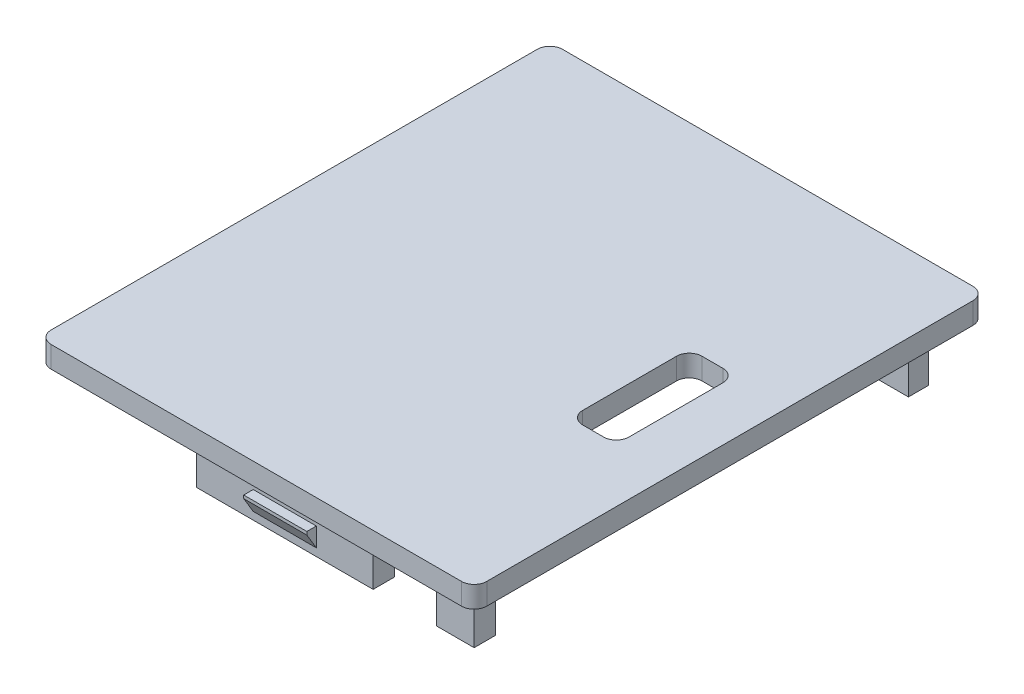
from build123d import *

# Parameters (mm, degrees)
SKETCH1_W           = 34.5
SKETCH1_H           = 40.5
BOSS_EXTRUDE1_DEPTH = 1.7
SKETCH2_W           = 3.66
SKETCH2_H           = 9.44
CUT_EXTRUDE1_DEPTH  = 1.7
FILLET1_R           = 1
FILLET2_R           = 1
FILLET3_R           = 1
FILLET4_R           = 1
FILLET5_R           = 1
FILLET6_R           = 1
FILLET7_R           = 1
FILLET8_R           = 1
SKETCH3_W           = 30
SKETCH3_H           = 1.6
BOSS_EXTRUDE2_DEPTH = 4.6
SKETCH4_W           = 3
SKETCH4_H           = 1.7
SKETCH4_W_2         = 14
BOSS_EXTRUDE3_DEPTH = 4.6
BOSS_EXTRUDE4_START = -14.75
BOSS_EXTRUDE4_DEPTH = 5
FILLET9_R           = 1
FILLET10_R          = 1
FILLET11_R          = 1


with BuildPart() as part:
    # Sketch1 → Boss-Extrude1 (new body)
    with BuildSketch(Plane(origin=(0, 0, 0), x_dir=(1, 0, 0), z_dir=(0, 1, 0))):
        with Locations((-2.298701299, -3.199675325)):
            Rectangle(SKETCH1_W, SKETCH1_H)
    extrude(amount=BOSS_EXTRUDE1_DEPTH)

    # Sketch2 → Cut-Extrude1 (cut)
    with BuildSketch(Plane(origin=(0, 1.7, 0), x_dir=(1, 0, 0), z_dir=(0, 1, 0))):
        with Locations((8.851298701, -3.199675325)):
            Rectangle(SKETCH2_W, SKETCH2_H)
    extrude(amount=-CUT_EXTRUDE1_DEPTH, mode=Mode.SUBTRACT)

    # Fillet1
    fillet1_edges = [part.edges().sort_by_distance(p)[0] for p in [
        (14.951298701, 0.85, 23.449675325),
    ]]
    fillet(fillet1_edges, radius=FILLET1_R)

    # Fillet2
    fillet2_edges = [part.edges().sort_by_distance(p)[0] for p in [
        (14.951298701, 0.85, -17.050324675),
    ]]
    fillet(fillet2_edges, radius=FILLET2_R)

    # Fillet3
    fillet3_edges = [part.edges().sort_by_distance(p)[0] for p in [
        (-19.548701299, 0.85, -17.050324675),
    ]]
    fillet(fillet3_edges, radius=FILLET3_R)

    # Fillet4
    fillet4_edges = [part.edges().sort_by_distance(p)[0] for p in [
        (-19.548701299, 0.85, 23.449675325),
    ]]
    fillet(fillet4_edges, radius=FILLET4_R)

    # Fillet5
    fillet5_edges = [part.edges().sort_by_distance(p)[0] for p in [
        (7.021298701, 0.85, 7.919675325),
    ]]
    fillet(fillet5_edges, radius=FILLET5_R)

    # Fillet6
    fillet6_edges = [part.edges().sort_by_distance(p)[0] for p in [
        (7.021298701, 0.85, -1.520324675),
    ]]
    fillet(fillet6_edges, radius=FILLET6_R)

    # Fillet7
    fillet7_edges = [part.edges().sort_by_distance(p)[0] for p in [
        (10.681298701, 0.85, 7.919675325),
    ]]
    fillet(fillet7_edges, radius=FILLET7_R)

    # Fillet8
    fillet8_edges = [part.edges().sort_by_distance(p)[0] for p in [
        (10.681298701, 0.85, -1.520324675),
    ]]
    fillet(fillet8_edges, radius=FILLET8_R)

    # Sketch3 → Boss-Extrude2 (add)
    with BuildSketch(Plane.XZ):
        with Locations((-2.298701299, -14.000324675)):
            Rectangle(SKETCH3_W, SKETCH3_H)
    extrude(amount=BOSS_EXTRUDE2_DEPTH)

    # Sketch4 → Boss-Extrude3 (add)
    with BuildSketch(Plane.XZ):
        with Locations((11.201298701, 20.349675325)):
            Rectangle(SKETCH4_W, SKETCH4_H)
        with Locations((-2.298701299, 20.349675325)):
            Rectangle(SKETCH4_W_2, SKETCH4_H)
    extrude(amount=BOSS_EXTRUDE3_DEPTH)

    # Sketch5 → Boss-Extrude4 (add)
    with BuildSketch(Plane(origin=(14.951298701, 0, 0), x_dir=(0, 0, -1), z_dir=(1, 0, 0)).offset(BOSS_EXTRUDE4_START)):
        Polygon((14.800324675, -2.5), (14.800324675, -4), (15.550324675, -2.75), (15.550324675, -2.5), align=None)
        Polygon((-21.949675325, -2.5), (-21.199675325, -2.5), (-21.199675325, -4), (-21.949675325, -2.75), align=None)
    extrude(amount=-BOSS_EXTRUDE4_DEPTH)

    # Fillet9
    fillet9_edges = [part.edges().sort_by_distance(p)[0] for p in [
        (11.201298701, 0, 19.499675325),
    ]]
    fillet(fillet9_edges, radius=FILLET9_R)

    # Fillet10
    fillet10_edges = [part.edges().sort_by_distance(p)[0] for p in [
        (-2.298701299, 0, 19.499675325),
    ]]
    fillet(fillet10_edges, radius=FILLET10_R)

    # Fillet11
    fillet11_edges = [part.edges().sort_by_distance(p)[0] for p in [
        (-2.298701299, 0, -13.200324675),
    ]]
    fillet(fillet11_edges, radius=FILLET11_R)


solid = part.part
